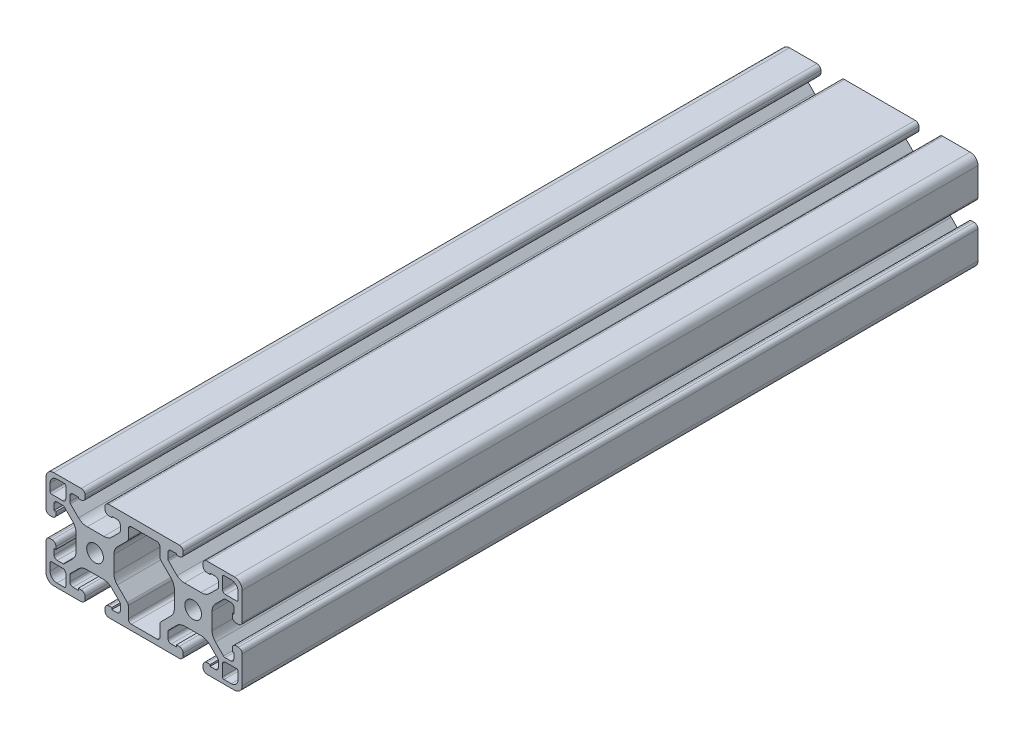
from build123d import *

# Parameters (mm, degrees)
SKETCH1_R      = 3.4
EXTRUDE1_DEPTH = 300


with BuildPart() as part:
    # Sketch1 → Extrude1 (new body)
    with BuildSketch(Plane.XY):
        with BuildLine():
            Line((-34.38, 20), (-5.62, 20))
            ThreePointArc((-5.62, 20), (-4.574261351, 19.60103829), (-4.06, 18.60691806))
            Line((-4.06, 18.60691806), (-4.06, 17.51))
            ThreePointArc((-4.06, 17.51), (-4.519842354, 16.399842354), (-5.63, 15.94))
            Line((-5.63, 15.94), (-6.848295327, 15.94))
            Line((-6.848295327, 15.94), (-6.848295327, 16.411729227))
            Line((-6.848295327, 16.411729227), (-8.956262543, 16.411729227))
            ThreePointArc((-8.956262543, 16.411729227), (-9.89201295, 16.061645977), (-10.285, 15.143088257))
            Line((-10.285, 15.143088257), (-10.285, 12.847645092))
            ThreePointArc((-10.285, 12.847645092), (-10.217146583, 12.506800558), (-10.023932594, 12.217927859))
            Line((-10.023932594, 12.217927859), (-6.541366663, 8.739701268))
            ThreePointArc((-6.541366663, 8.739701268), (-5.14376203, 7.966343661), (-3.568820203, 7.7))
            Line((-3.568820203, 7.7), (3.18718254, 7.7))
            ThreePointArc((3.18718254, 7.7), (5.111909818, 8.02014308), (6.745550907, 9.087046766))
            Line((6.745550907, 9.087046766), (10.024325035, 12.365820894))
            ThreePointArc((10.024325035, 12.365820894), (10.217252784, 12.654557674), (10.285, 12.995145929))
            Line((10.285, 12.995145929), (10.285, 15.086937017))
            ThreePointArc((10.285, 15.086937017), (9.913025612, 15.984962629), (9.015, 16.356937017))
            Line((9.015, 16.356937017), (6.848295327, 16.356937017))
            Line((6.848295327, 16.356937017), (6.848295327, 15.88520779))
            Line((6.848295327, 15.88520779), (5.63, 15.88520779))
            ThreePointArc((5.63, 15.88520779), (4.519842354, 16.345050144), (4.06, 17.45520779))
            Line((4.06, 17.45520779), (4.06, 18.43))
            ThreePointArc((4.06, 18.43), (4.519842354, 19.540157646), (5.63, 20))
            Line((5.63, 20), (14.281820422, 20))
            Line((14.281820422, 20), (16.83, 20))
            ThreePointArc((16.83, 20), (19.071528496, 19.071528496), (20, 16.83))
            Line((20, 16.83), (20, 13))
            Line((20, 13), (20, 5.571883806))
            ThreePointArc((20, 5.571883806), (19.520492841, 4.499481643), (18.431075989, 4.059999631))
            Line((18.431075989, 4.059999631), (17.51, 4.059999631))
            ThreePointArc((17.51, 4.059999631), (16.399842354, 4.519841985), (15.94, 5.629999631))
            Line((15.94, 5.629999631), (15.94, 6.696409732))
            Line((15.94, 6.696409732), (16.715022223, 6.696409732))
            Line((16.715022223, 6.696409732), (16.715022223, 9.02))
            ThreePointArc((16.715022223, 9.02), (16.343047835, 9.918025612), (15.445022223, 10.29))
            Line((15.445022223, 10.29), (13.15011805, 10.29))
            ThreePointArc((13.15011805, 10.29), (12.809529795, 10.222252784), (12.520793015, 10.029325035))
            Line((12.520793015, 10.029325035), (9.091242789, 6.59977481))
            ThreePointArc((9.091242789, 6.59977481), (8.061572221, 5.058763903), (7.7, 3.241017599))
            Line((7.7, 3.241017599), (7.7, -3.514985144))
            ThreePointArc((7.7, -3.514985144), (8.061005845, -5.331363493), (9.089149602, -6.871647862))
            Line((9.089149602, -6.871647862), (12.377834665, -10.164435797))
            ThreePointArc((12.377834665, -10.164435797), (12.666707364, -10.357649787), (13.007551897, -10.425503204))
            Line((13.007551897, -10.425503204), (15.30245607, -10.425503204))
            ThreePointArc((15.30245607, -10.425503204), (16.200481682, -10.053528816), (16.57245607, -9.155503204))
            Line((16.57245607, -9.155503204), (16.57245607, -6.779901474))
            Line((16.57245607, -6.779901474), (15.94, -6.779901474))
            Line((15.94, -6.779901474), (15.94, -5.569550674))
            ThreePointArc((15.94, -5.569550674), (16.399842354, -4.459393028), (17.51, -3.999550674))
            Line((17.51, -3.999550674), (18.43, -3.999550674))
            ThreePointArc((18.43, -3.999550674), (19.540157646, -4.459393028), (20, -5.569550674))
            Line((20, -5.569550674), (20, -16.83))
            ThreePointArc((20, -16.83), (19.071528496, -19.071528496), (16.83, -20))
            Line((16.83, -20), (14.322274694, -20))
            Line((14.322274694, -20), (5.694366927, -20))
            ThreePointArc((5.694366927, -20), (4.542837301, -19.564006433), (4.059999445, -18.431320037))
            Line((4.059999445, -18.431320037), (4.059999445, -17.45520779))
            ThreePointArc((4.059999445, -17.45520779), (4.519841799, -16.345050144), (5.629999445, -15.88520779))
            Line((5.629999445, -15.88520779), (6.907032762, -15.88520779))
            Line((6.907032762, -15.88520779), (6.907032762, -16.558380889))
            Line((6.907032762, -16.558380889), (9.015, -16.558380889))
            ThreePointArc((9.015, -16.558380889), (9.913025612, -16.186406501), (10.285, -15.288380889))
            Line((10.285, -15.288380889), (10.285, -12.829086847))
            ThreePointArc((10.285, -12.829086847), (10.217252784, -12.488498592), (10.024325035, -12.199761812))
            Line((10.024325035, -12.199761812), (6.739188515, -8.914625291))
            ThreePointArc((6.739188515, -8.914625291), (5.199545386, -7.885521524), (3.383392441, -7.523383425))
            Line((3.383392441, -7.523383425), (-3.380431304, -7.523383425))
            ThreePointArc((-3.380431304, -7.523383425), (-5.198177608, -7.884955645), (-6.739188515, -8.914626214))
            Line((-6.739188515, -8.914626214), (-10.024325035, -12.199762735))
            ThreePointArc((-10.024325035, -12.199762735), (-10.217252784, -12.488499515), (-10.285, -12.82908777))
            Line((-10.285, -12.82908777), (-10.285, -15.368632999))
            ThreePointArc((-10.285, -15.368632999), (-9.869779979, -16.230781197), (-8.970677639, -16.558381812))
            Line((-8.970677639, -16.558381812), (-6.828250761, -16.558381812))
            Line((-6.828250761, -16.558381812), (-6.828250761, -15.813027771))
            Line((-6.828250761, -15.813027771), (-5.694367402, -15.813027771))
            ThreePointArc((-5.694367402, -15.813027771), (-4.538695129, -16.2917229), (-4.06, -17.447395173))
            Line((-4.06, -17.447395173), (-4.06, -18.365632122))
            ThreePointArc((-4.06, -18.365632122), (-4.538694961, -19.521304703), (-5.694367402, -20))
            Line((-5.694367402, -20), (-13.060449326, -20))
            Line((-13.060449326, -20), (-26.939550674, -20))
            Line((-26.939550674, -20), (-34.305633073, -20))
            ThreePointArc((-34.305633073, -20), (-35.461305039, -19.521304703), (-35.94, -18.365632598))
            Line((-35.94, -18.365632598), (-35.94, -17.447395173))
            ThreePointArc((-35.94, -17.447395173), (-35.461304871, -16.2917229), (-34.305632598, -15.813027771))
            Line((-34.305632598, -15.813027771), (-33.171749239, -15.813027771))
            Line((-33.171749239, -15.813027771), (-33.171749239, -16.558380889))
            Line((-33.171749239, -16.558380889), (-31.029322361, -16.558380889))
            ThreePointArc((-31.029322361, -16.558380889), (-30.130220021, -16.230780274), (-29.715, -15.368632076))
            Line((-29.715, -15.368632076), (-29.715, -12.829086847))
            ThreePointArc((-29.715, -12.829086847), (-29.782747216, -12.488498592), (-29.975674965, -12.199761812))
            Line((-29.975674965, -12.199761812), (-33.260811485, -8.914625291))
            ThreePointArc((-33.260811485, -8.914625291), (-34.801822392, -7.884954722), (-36.619568696, -7.523382502))
            Line((-36.619568696, -7.523382502), (-43.380431304, -7.523382502))
            ThreePointArc((-43.380431304, -7.523382502), (-45.198177608, -7.884954722), (-46.739188515, -8.914625291))
            Line((-46.739188515, -8.914625291), (-50.024325035, -12.199761812))
            ThreePointArc((-50.024325035, -12.199761812), (-50.217252784, -12.488498592), (-50.285, -12.829086847))
            Line((-50.285, -12.829086847), (-50.285, -15.288380889))
            ThreePointArc((-50.285, -15.288380889), (-49.913025612, -16.186406501), (-49.015, -16.558380889))
            Line((-49.015, -16.558380889), (-46.828250761, -16.558380889))
            Line((-46.828250761, -16.558380889), (-46.828250761, -15.813027771))
            Line((-46.828250761, -15.813027771), (-45.694367402, -15.813027771))
            ThreePointArc((-45.694367402, -15.813027771), (-44.538695129, -16.2917229), (-44.06, -17.447395173))
            Line((-44.06, -17.447395173), (-44.06, -18.365632598))
            ThreePointArc((-44.06, -18.365632598), (-44.538694961, -19.521304703), (-45.694366927, -20))
            Line((-45.694366927, -20), (-56.83, -20))
            ThreePointArc((-56.83, -20), (-59.071528496, -19.071528496), (-60, -16.83))
            Line((-60, -16.83), (-60, -5.571883806))
            ThreePointArc((-60, -5.571883806), (-59.520492841, -4.499481643), (-58.431075989, -4.059999631))
            Line((-58.431075989, -4.059999631), (-57.51, -4.06))
            ThreePointArc((-57.51, -4.06), (-56.399842354, -4.519842354), (-55.94, -5.63))
            Line((-55.94, -5.63), (-55.94, -6.696410101))
            Line((-55.94, -6.696410101), (-56.715022223, -6.696410101))
            Line((-56.715022223, -6.696410101), (-56.715022223, -9.02))
            ThreePointArc((-56.715022223, -9.02), (-56.343047835, -9.918025612), (-55.445022223, -10.29))
            Line((-55.445022223, -10.29), (-53.15011805, -10.29))
            ThreePointArc((-53.15011805, -10.29), (-52.809529795, -10.222252784), (-52.520793015, -10.029325035))
            Line((-52.520793015, -10.029325035), (-49.091242789, -6.59977481))
            ThreePointArc((-49.091242789, -6.59977481), (-48.061572221, -5.058763903), (-47.7, -3.241017599))
            Line((-47.7, -3.241017599), (-47.7, 3.241017599))
            ThreePointArc((-47.7, 3.241017599), (-48.061572221, 5.058763903), (-49.091242789, 6.59977481))
            Line((-49.091242789, 6.59977481), (-52.520793015, 10.029325035))
            ThreePointArc((-52.520793015, 10.029325035), (-52.809529795, 10.222252784), (-53.15011805, 10.29))
            Line((-53.15011805, 10.29), (-55.445022223, 10.29))
            ThreePointArc((-55.445022223, 10.29), (-56.343047835, 9.918025612), (-56.715022223, 9.02))
            Line((-56.715022223, 9.02), (-56.715022223, 6.696410101))
            Line((-56.715022223, 6.696410101), (-55.94, 6.696410101))
            Line((-55.94, 6.696410101), (-55.94, 5.63))
            ThreePointArc((-55.94, 5.63), (-56.399842354, 4.519842354), (-57.51, 4.06))
            Line((-57.51, 4.06), (-58.431075989, 4.059999631))
            ThreePointArc((-58.431075989, 4.059999631), (-59.520492841, 4.499481643), (-60, 5.571883806))
            Line((-60, 5.571883806), (-60, 13))
            Line((-60, 13), (-60, 16.83))
            ThreePointArc((-60, 16.83), (-59.071528496, 19.071528496), (-56.83, 20))
            Line((-56.83, 20), (-45.63, 20))
            ThreePointArc((-45.63, 20), (-44.519842354, 19.540157646), (-44.06, 18.43))
            Line((-44.06, 18.43), (-44.06, 17.45520779))
            ThreePointArc((-44.06, 17.45520779), (-44.519842354, 16.345050144), (-45.63, 15.88520779))
            Line((-45.63, 15.88520779), (-46.848295327, 15.88520779))
            Line((-46.848295327, 15.88520779), (-46.848295327, 16.356937017))
            Line((-46.848295327, 16.356937017), (-49.015, 16.356937017))
            ThreePointArc((-49.015, 16.356937017), (-49.913025612, 15.984962629), (-50.285, 15.086937017))
            Line((-50.285, 15.086937017), (-50.285, 12.995145929))
            ThreePointArc((-50.285, 12.995145929), (-50.217252784, 12.654557674), (-50.024325035, 12.365820894))
            Line((-50.024325035, 12.365820894), (-46.745550907, 9.087046766))
            ThreePointArc((-46.745550907, 9.087046766), (-45.111909818, 8.02014308), (-43.18718254, 7.7))
            Line((-43.18718254, 7.7), (-36.42447528, 7.7))
            ThreePointArc((-36.42447528, 7.7), (-34.853074074, 7.967456275), (-33.458633337, 8.739706))
            Line((-33.458633337, 8.739706), (-29.976067406, 12.217932591))
            ThreePointArc((-29.976067406, 12.217932591), (-29.782853417, 12.50680529), (-29.715, 12.847649823))
            Line((-29.715, 12.847649823), (-29.715, 15.143088257))
            ThreePointArc((-29.715, 15.143088257), (-30.107987042, 16.061645969), (-31.043737435, 16.411729227))
            Line((-31.043737435, 16.411729227), (-33.151704673, 16.411729227))
            Line((-33.151704673, 16.411729227), (-33.151704673, 15.94))
            Line((-33.151704673, 15.94), (-34.37, 15.94))
            ThreePointArc((-34.37, 15.94), (-35.480157646, 16.399842354), (-35.94, 17.51))
            Line((-35.94, 17.51), (-35.94, 18.60691806))
            ThreePointArc((-35.94, 18.60691806), (-35.425738649, 19.60103829), (-34.38, 20))
        make_face()
        with Locations((-40, 0)):
            Circle(SKETCH1_R, mode=Mode.SUBTRACT)
        with Locations(Location((0, 0, 0), (0, 0, 180))):
            Circle(SKETCH1_R, mode=Mode.SUBTRACT)
        with BuildLine():
            Line((-30.939717555, -6.735226492), (-26.832379884, -10.842564163))
            ThreePointArc((-26.832379884, -10.842564163), (-26.55707849, -11.254581816), (-26.460405496, -11.740589775))
            Line((-26.460405496, -11.740589775), (-26.460405496, -16.447436081))
            ThreePointArc((-26.460405496, -16.447436081), (-26.088431108, -17.345461693), (-25.190405496, -17.717436081))
            Line((-25.190405496, -17.717436081), (-14.809594504, -17.717436081))
            ThreePointArc((-14.809594504, -17.717436081), (-13.911568892, -17.345461693), (-13.539594504, -16.447436081))
            Line((-13.539594504, -16.447436081), (-13.539594504, -11.740589775))
            ThreePointArc((-13.539594504, -11.740589775), (-13.442921131, -11.254581958), (-13.167619463, -10.842564566))
            Line((-13.167619463, -10.842564566), (-9.062375632, -6.737320735))
            ThreePointArc((-9.062375632, -6.737320735), (-8.032138688, -5.194941873), (-7.671133766, -3.375602388))
            Line((-7.671133766, -3.375602388), (-7.675346726, 3.3824627))
            ThreePointArc((-7.675346726, 3.3824627), (-8.038052054, 5.199983248), (-9.068683085, 6.740351962))
            Line((-9.068683085, 6.740351962), (-13.17858046, 10.845128331))
            ThreePointArc((-13.17858046, 10.845128331), (-13.453881854, 11.257145984), (-13.550554848, 11.743153943))
            Line((-13.550554848, 11.743153943), (-13.550554848, 15.430000252))
            ThreePointArc((-13.550554848, 15.430000252), (-13.922527865, 16.328024493), (-14.820550972, 16.700000252))
            Line((-14.820550972, 16.700000252), (-20.000001006, 16.696771398))
            Line((-20.000001006, 16.696771398), (-25.178653438, 16.699999756))
            ThreePointArc((-25.178653438, 16.699999756), (-26.077190808, 16.328305483), (-26.449445152, 15.43))
            Line((-26.449445152, 15.43), (-26.449445152, 11.743153694))
            ThreePointArc((-26.449445152, 11.743153694), (-26.546118146, 11.257145735), (-26.82141954, 10.845128082))
            Line((-26.82141954, 10.845128082), (-30.931316915, 6.740351712))
            ThreePointArc((-30.931316915, 6.740351712), (-31.961947946, 5.199982999), (-32.324653274, 3.382462451))
            Line((-32.324653274, 3.382462451), (-32.328866234, -3.375602637))
            ThreePointArc((-32.328866234, -3.375602637), (-31.968427261, -5.193573991), (-30.939717555, -6.735226492))
        make_face(mode=Mode.SUBTRACT)
        with BuildLine():
            Line((-57.72, 11.94), (-53.21, 11.94))
            ThreePointArc((-53.21, 11.94), (-52.308743898, 12.310198515), (-51.935, 13.209990157))
            Line((-51.935, 13.209990157), (-51.935, 17.72))
            ThreePointArc((-51.935, 17.72), (-52.119522728, 18.165477272), (-52.565, 18.35))
            Line((-52.565, 18.35), (-55.545, 18.35))
            ThreePointArc((-55.545, 18.35), (-57.524898987, 17.529898987), (-58.345, 15.55))
            Line((-58.345, 15.55), (-58.345, 12.569980158))
            ThreePointArc((-58.345, 12.569980158), (-58.162241545, 12.126274175), (-57.72, 11.94))
        make_face(mode=Mode.SUBTRACT)
        with BuildLine():
            Line((-51.935, -17.72), (-51.935, -13.209990157))
            ThreePointArc((-51.935, -13.209990157), (-52.308743898, -12.310198515), (-53.21, -11.94))
            Line((-53.21, -11.94), (-57.72, -11.94))
            ThreePointArc((-57.72, -11.94), (-58.162241545, -12.126274175), (-58.345, -12.569980158))
            Line((-58.345, -12.569980158), (-58.345, -15.55))
            ThreePointArc((-58.345, -15.55), (-57.524898987, -17.529898987), (-55.545, -18.35))
            Line((-55.545, -18.35), (-52.565, -18.35))
            ThreePointArc((-52.565, -18.35), (-52.119522728, -18.165477272), (-51.935, -17.72))
        make_face(mode=Mode.SUBTRACT)
        with BuildLine():
            Line((18.345, -15.55), (18.345, -12.57))
            ThreePointArc((18.345, -12.57), (18.162248533, -12.126281217), (17.72, -11.94))
            Line((17.72, -11.94), (13.21, -11.94))
            ThreePointArc((13.21, -11.94), (12.308743898, -12.310198515), (11.935, -13.209990157))
            Line((11.935, -13.209990157), (11.935, -17.72))
            ThreePointArc((11.935, -17.72), (12.119522728, -18.165477272), (12.565, -18.35))
            Line((12.565, -18.35), (15.545, -18.35))
            ThreePointArc((15.545, -18.35), (17.524898987, -17.529898987), (18.345, -15.55))
        make_face(mode=Mode.SUBTRACT)
        with BuildLine():
            Line((18.345, 15.55), (18.345, 12.57))
            ThreePointArc((18.345, 12.57), (18.162248533, 12.126281217), (17.72, 11.94))
            Line((17.72, 11.94), (13.21, 11.94))
            ThreePointArc((13.21, 11.94), (12.308743898, 12.310198515), (11.935, 13.209990157))
            Line((11.935, 13.209990157), (11.935, 17.72))
            ThreePointArc((11.935, 17.72), (12.119522728, 18.165477272), (12.565, 18.35))
            Line((12.565, 18.35), (15.545, 18.35))
            ThreePointArc((15.545, 18.35), (17.524898987, 17.529898987), (18.345, 15.55))
        make_face(mode=Mode.SUBTRACT)
    extrude(amount=-EXTRUDE1_DEPTH)


solid = part.part
